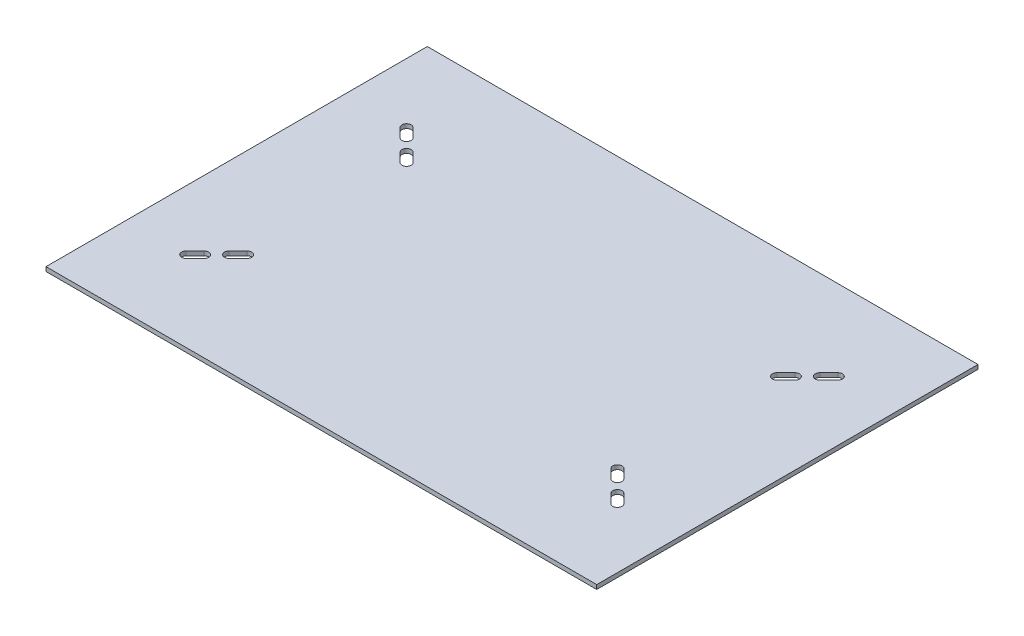
from build123d import *

# Parameters (mm, degrees)
SKETCH1_W          = 330.2
SKETCH1_H          = 228.6
BASE_PLATE_DEPTH   = 2.54
CUT_EXTRUDE9_DEPTH = 402.617294946


with BuildPart() as part:
    # Sketch1 → base plate (new body)
    with BuildSketch(Plane(origin=(0, 0, 0), x_dir=(1, 0, 0), z_dir=(0, 1, 0))):
        with Locations((165.1, -114.3)):
            Rectangle(SKETCH1_W, SKETCH1_H)
    extrude(amount=-BASE_PLATE_DEPTH)

    # Sketch3 → Cut-Extrude9 (cut, through all)
    with BuildSketch(Plane(origin=(0, 0, 0), x_dir=(1, 0, 0), z_dir=(0, 1, 0))):
        with BuildLine():
            ThreePointArc((43.160130962, -51.670448323), (43.160130962, -55.559535744), (39.271043541, -55.559535744))
            Line((39.271043541, -55.559535744), (33.882889868, -50.171382072))
            ThreePointArc((33.882889868, -50.171382072), (33.882889868, -46.282294651), (37.771977289, -46.282294651))
            Line((37.771977289, -46.282294651), (43.160130962, -51.670448323))
        make_face()
        with BuildLine():
            Line((292.428022711, -46.282294651), (287.039869038, -51.670448323))
            ThreePointArc((287.039869038, -51.670448323), (287.039869038, -55.559535744), (290.928956459, -55.559535744))
            Line((290.928956459, -55.559535744), (296.317110132, -50.171382072))
            ThreePointArc((296.317110132, -50.171382072), (296.317110132, -46.282294651), (292.428022711, -46.282294651))
        make_face()
        with BuildLine():
            Line((278.059612917, -68.428879286), (283.44776659, -63.040725614))
            ThreePointArc((283.44776659, -63.040725614), (283.44776659, -59.151638193), (279.558679169, -59.151638193))
            Line((279.558679169, -59.151638193), (274.170525496, -64.539791865))
            ThreePointArc((274.170525496, -64.539791865), (274.170525496, -68.428879286), (278.059612917, -68.428879286))
        make_face()
        with BuildLine():
            ThreePointArc((283.44776659, -165.559274386), (283.44776659, -169.448361807), (279.558679169, -169.448361807))
            Line((279.558679169, -169.448361807), (274.170525496, -164.060208135))
            ThreePointArc((274.170525496, -164.060208135), (274.170525496, -160.171120714), (278.059612917, -160.171120714))
            Line((278.059612917, -160.171120714), (283.44776659, -165.559274386))
        make_face()
        with BuildLine():
            ThreePointArc((287.039869038, -176.929551677), (287.039869038, -173.040464256), (290.928956459, -173.040464256))
            Line((290.928956459, -173.040464256), (296.317110132, -178.428617928))
            ThreePointArc((296.317110132, -178.428617928), (296.317110132, -182.317705349), (292.428022711, -182.317705349))
            Line((292.428022711, -182.317705349), (287.039869038, -176.929551677))
        make_face()
        with BuildLine():
            Line((37.771977289, -182.317705349), (43.160130962, -176.929551677))
            ThreePointArc((43.160130962, -176.929551677), (43.160130962, -173.040464256), (39.271043541, -173.040464256))
            Line((39.271043541, -173.040464256), (33.882889868, -178.428617928))
            ThreePointArc((33.882889868, -178.428617928), (33.882889868, -182.317705349), (37.771977289, -182.317705349))
        make_face()
        with BuildLine():
            Line((52.140387083, -160.171120714), (46.75223341, -165.559274386))
            ThreePointArc((46.75223341, -165.559274386), (46.75223341, -169.448361807), (50.641320831, -169.448361807))
            Line((50.641320831, -169.448361807), (56.029474504, -164.060208135))
            ThreePointArc((56.029474504, -164.060208135), (56.029474504, -160.171120714), (52.140387083, -160.171120714))
        make_face()
        with BuildLine():
            Line((52.140387083, -68.428879286), (46.75223341, -63.040725614))
            ThreePointArc((46.75223341, -63.040725614), (46.75223341, -59.151638193), (50.641320831, -59.151638193))
            Line((50.641320831, -59.151638193), (56.029474504, -64.539791865))
            ThreePointArc((56.029474504, -64.539791865), (56.029474504, -68.428879286), (52.140387083, -68.428879286))
        make_face()
    extrude(amount=-CUT_EXTRUDE9_DEPTH, mode=Mode.SUBTRACT)


solid = part.part
